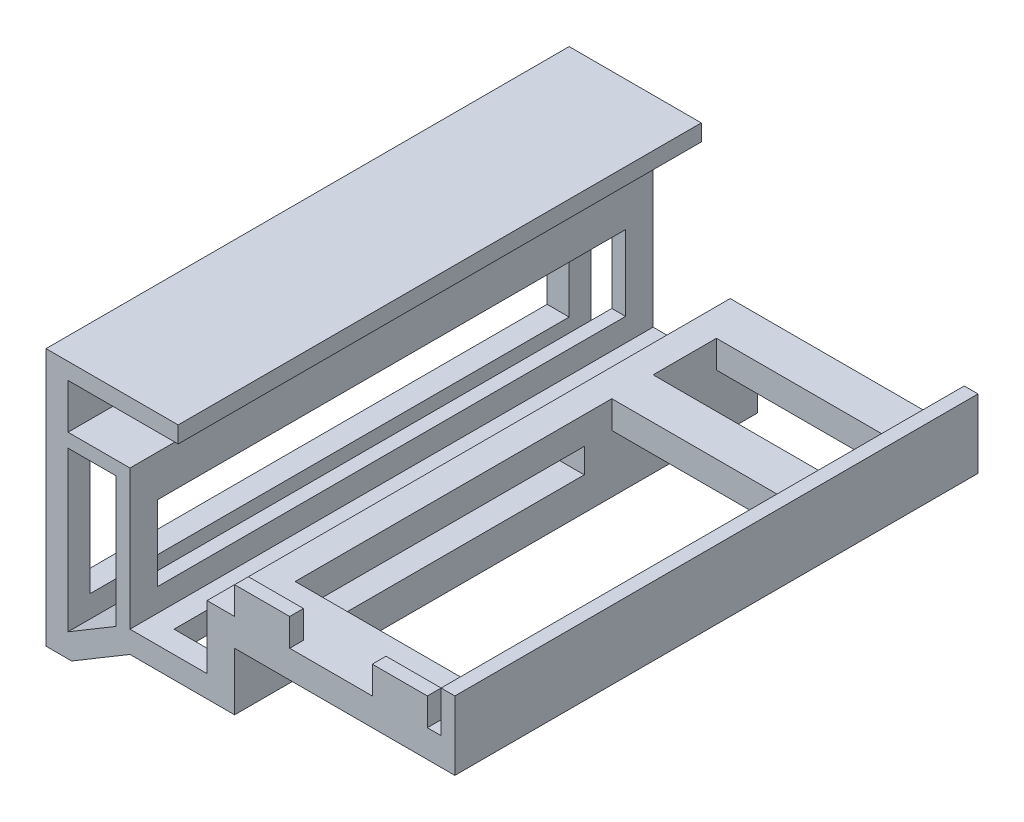
from build123d import *

# Parameters (mm, degrees)
EXTRUDE_1_DEPTH        = 190
CUT_EXTRUDE_1_DEPTH    = 235.752853891
SKETCH_4_W             = 75
SKETCH_4_H             = 23
CUT_EXTRUDE_2_DEPTH    = 230.181151057
SKETCH_6_W             = 75
SKETCH_6_H             = 115
CUT_EXTRUDE_3_DEPTH    = 230.181151057
SKETCH_7_W             = 20
SKETCH_7_H             = 5
EXTRUDE_3_DEPTH        = 10
PATTERN_LINEAR_1_COUNT = 2
PATTERN_LINEAR_1_PITCH = 50
CUT_EXTRUDE_4_REACH    = 220.14
SKETCH_8_W             = 95
SKETCH_8_H             = 8.95125425
CUT_EXTRUDE_5_REACH    = 237.272
SKETCH_9_W             = 12
SKETCH_9_H             = 174
CUT_EXTRUDE_6_REACH    = 239.306
SKETCH_10_W            = 170
SKETCH_10_H            = 27.319431914
CUT_EXTRUDE_7_REACH    = 248.83
SKETCH_12_W            = 174
SKETCH_12_H            = 41.774248955


with BuildPart() as part:
    # 草图1 → 凸台-拉伸1 (new body)
    with BuildSketch(Plane.XY):
        Polygon((0, 0), (-22.5, 0), (-22.5, 16.3), (17.5, 16.3), (17.5, 22.3), (-30.5, 22.3), (-30.5, -71.308501668), (-21.186581166, -71.308501668), (0, -58.65125425), (38, -58.65125425), (38, -37.7), (118, -37.7), (118, -12.7), (113, -12.7), (113, -27.7), (28, -27.7), (28, -50.7), (0, -50.7), align=None)
    extrude(amount=EXTRUDE_1_DEPTH)

    # 草图2 → 切除-拉伸1 (cut, through all)
    with BuildSketch(Plane.XY.offset(190)):
        Polygon((-22.5, -5), (-22.5, -62.774248955), (-5, -52.319431914), (-5, -5), align=None)
    extrude(amount=-CUT_EXTRUDE_1_DEPTH, mode=Mode.SUBTRACT)

    # 草图4 → 切除-拉伸2 (cut, through all)
    with BuildSketch(Plane(origin=(0, -27.7, 0), x_dir=(1, 0, 0), z_dir=(0, 1, 0))):
        with Locations((75.5, -26.5)):
            Rectangle(SKETCH_4_W, SKETCH_4_H)
    extrude(amount=-CUT_EXTRUDE_2_DEPTH, mode=Mode.SUBTRACT)

    # 草图6 → 切除-拉伸3 (cut, through all)
    with BuildSketch(Plane(origin=(0, -27.7, 0), x_dir=(1, 0, 0), z_dir=(0, 1, 0))):
        with Locations((75.5, -110.5)):
            Rectangle(SKETCH_6_W, SKETCH_6_H)
    extrude(amount=-CUT_EXTRUDE_3_DEPTH, mode=Mode.SUBTRACT)

    # 草图7 → 凸台-拉伸3 (add)
    with BuildSketch(Plane(origin=(0, -27.7, 0), x_dir=(1, 0, 0), z_dir=(0, 1, 0))):
        with Locations((48, -187.5)):
            Rectangle(SKETCH_7_W, SKETCH_7_H)
    extrude_3 = extrude(amount=EXTRUDE_3_DEPTH)

    # 阵列(线性)1: 凸台-拉伸3 ×2
    with Locations(*[(i * PATTERN_LINEAR_1_PITCH, 0, 0) for i in range(1, PATTERN_LINEAR_1_COUNT)]):
        add(extrude_3)

    # 草图8 → 切除-拉伸4 (cut, up to next)
    with BuildSketch(Plane(origin=(38, 0, 0), x_dir=(0, 0, -1), z_dir=(1, 0, 0)), mode=Mode.PRIVATE) as cut_extrude_4_sk1:
        with Locations((-110.5, -42.175627125)):
            Rectangle(SKETCH_8_W, SKETCH_8_H)
    cut_extrude_4_tool1 = extrude(cut_extrude_4_sk1.sketch, amount=-CUT_EXTRUDE_4_REACH, mode=Mode.PRIVATE) & part.part
    add(cut_extrude_4_tool1.solids().sort_by_distance((38, -42.175627, 110.5))[0], mode=Mode.SUBTRACT)

    # 草图9 → 切除-拉伸5 (cut, up to next)
    with BuildSketch(Plane(origin=(0, -50.7, 0), x_dir=(1, 0, 0), z_dir=(0, 1, 0)), mode=Mode.PRIVATE) as cut_extrude_5_sk1:
        with Locations((14, -95)):
            Rectangle(SKETCH_9_W, SKETCH_9_H)
    cut_extrude_5_tool1 = extrude(cut_extrude_5_sk1.sketch, amount=-CUT_EXTRUDE_5_REACH, mode=Mode.PRIVATE) & part.part
    add(cut_extrude_5_tool1.solids().sort_by_distance((14, -50.7, 95))[0], mode=Mode.SUBTRACT)

    # 草图10 → 切除-拉伸6 (cut, up to next)
    with BuildSketch(Plane.ZY.offset(5), mode=Mode.PRIVATE) as cut_extrude_6_sk1:
        with Locations((95, -28.659715957)):
            Rectangle(SKETCH_10_W, SKETCH_10_H)
    cut_extrude_6_tool1 = extrude(cut_extrude_6_sk1.sketch, amount=-CUT_EXTRUDE_6_REACH, mode=Mode.PRIVATE) & part.part
    add(cut_extrude_6_tool1.solids().sort_by_distance((-5, -28.659716, 95))[0], mode=Mode.SUBTRACT)

    # 草图12 → 切除-拉伸7 (cut, up to next)
    with BuildSketch(Plane(origin=(-22.5, 0, 0), x_dir=(0, 0, -1), z_dir=(1, 0, 0)), mode=Mode.PRIVATE) as cut_extrude_7_sk1:
        with Locations((-95, -33.887124478)):
            Rectangle(SKETCH_12_W, SKETCH_12_H)
    cut_extrude_7_tool1 = extrude(cut_extrude_7_sk1.sketch, amount=-CUT_EXTRUDE_7_REACH, mode=Mode.PRIVATE) & part.part
    add(cut_extrude_7_tool1.solids().sort_by_distance((-22.5, -33.887124, 95))[0], mode=Mode.SUBTRACT)


solid = part.part
